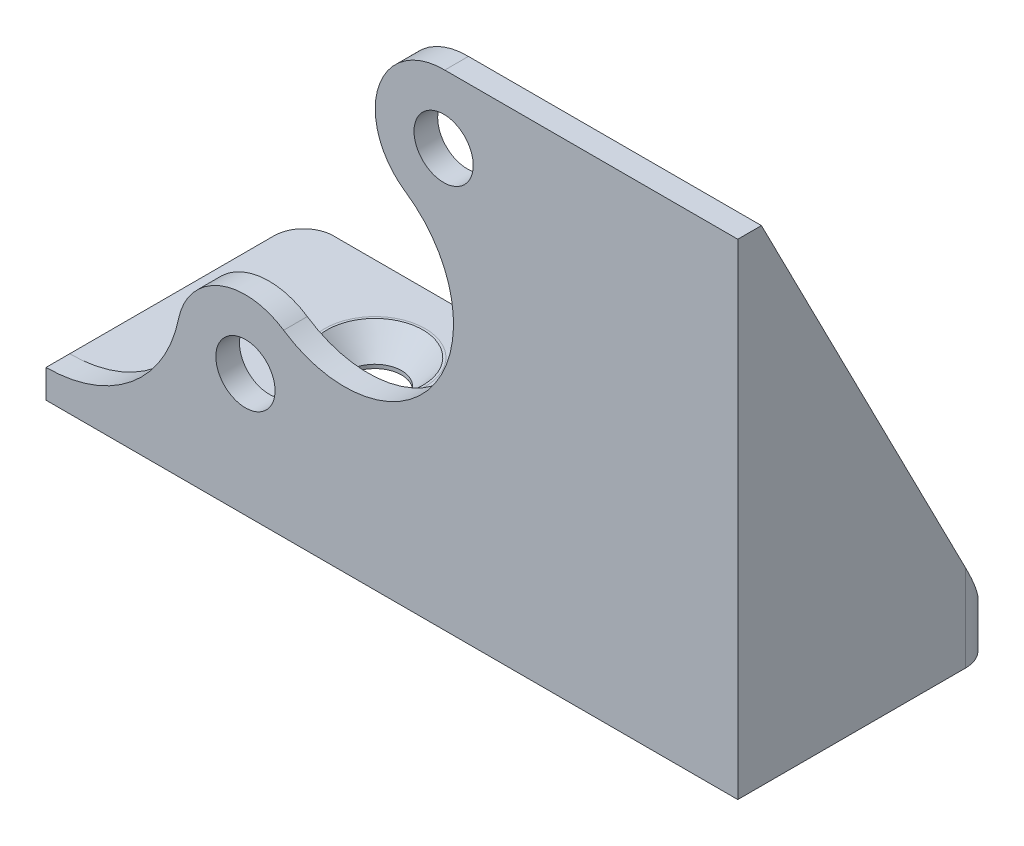
from build123d import *

# Parameters (mm, degrees)
SKETCH2_W                                   = 101.6
SKETCH2_H                                   = 127
BOSS_EXTRUDE1_DEPTH                         = 3.175
SKETCH5_R                                   = 3.9751
CUT_EXTRUDE1_DEPTH                          = 3.175
BOSS_EXTRUDE3_DEPTH                         = 92.87256
BOSS_EXTRUDE4_DEPTH                         = 6.35
SKETCH18_R                                  = 3.175
CUT_EXTRUDE3_DEPTH                          = 6.8072
FILLET4_R                                   = 4.0005
CUT_EXTRUDE4_DEPTH                          = 34.5948
CUT_EXTRUDE5_DEPTH                          = 2.9972
FILLET7_R                                   = 6.35
CSK_FOR_1_4_FLAT_HEAD_MACHINE_SCREW_2_COUNT = 2
CSK_FOR_1_4_FLAT_HEAD_MACHINE_SCREW_2_PITCH = 55.9
SKETCH36_R                                  = 6.4389
CUT_EXTRUDE6_DEPTH                          = 2.54


with BuildPart() as part:
    # Sketch2 → Boss-Extrude1 (new body)
    with BuildSketch(Plane.XY):
        with Locations((50.8, 63.5)):
            Rectangle(SKETCH2_W, SKETCH2_H)
    extrude(amount=BOSS_EXTRUDE1_DEPTH)

    # Sketch5 → Cut-Extrude1 (cut)
    with BuildSketch(Plane(origin=(0, 0, 0), x_dir=(-1, 0, 0), z_dir=(0, 0, -1))):
        with BuildLine():
            Line((-81.586228812, 65.152573183), (-58.571239337, 65.152573183))
            ThreePointArc((-58.571239337, 65.152573183), (-49.65943867, 58.729036089), (-53.287760408, 48.359981104))
            ThreePointArc((-53.287760408, 48.359981104), (-57.249364207, 28.049269577), (-36.93865268, 24.087665778))
            ThreePointArc((-36.93865268, 24.087665778), (-28.337713232, 24.971703827), (-22.817162059, 18.317291951))
            ThreePointArc((-22.817162059, 18.317291951), (-16.509170131, 7.896881921), (-5.03428, 3.81))
            Line((-5.03428, 3.81), (-5.03428, 0))
            Line((-5.03428, 0), (0, 0))
            Line((0, 0), (0, 127))
            Line((0, 127), (-101.6, 127))
            Line((-101.6, 127), (-101.6, 0))
            Line((-101.6, 0), (-97.90684, 0))
            Line((-97.90684, 0), (-97.90684, 65.152573183))
            Line((-97.90684, 65.152573183), (-81.586228812, 65.152573183))
        make_face()
        with Locations((-58.416247506, 55.973867932)):
            Circle(SKETCH5_R)
        with Locations((-31.810165582, 16.473778949)):
            Circle(SKETCH5_R)
    extrude(amount=-CUT_EXTRUDE1_DEPTH, mode=Mode.SUBTRACT)

    # Sketch10 → Boss-Extrude3 (add)
    with BuildSketch(Plane(origin=(5.03428, 0, 0), x_dir=(0, 0, -1), z_dir=(1, 0, 0))):
        Polygon((-3.175, 0), (-4.2418, 0), (-4.2418, -2.9972), (-34.5948, -2.9972), (-34.5948, 0), (-34.5948, 3.81), (-3.175, 3.81), align=None)
    extrude(amount=BOSS_EXTRUDE3_DEPTH)

    # Sketch11 → Boss-Extrude4 (add)
    with BuildSketch(Plane(origin=(97.90684, 0, 0), x_dir=(0, 0, -1), z_dir=(1, 0, 0))):
        Polygon((-3.175, 65.152573183), (-3.175, 3.81), (-34.5948, 3.81), align=None)
    extrude(amount=-BOSS_EXTRUDE4_DEPTH)

    # Sketch18 → Cut-Extrude3 (cut)
    with BuildSketch(Plane.XZ.offset(2.9972)):
        with Locations(Location((25.968032816, 23.228300068, 0), (0, 0, 270))):
            Circle(SKETCH18_R)
        with Locations(Location((81.868032816, 23.228300068, 0), (0, 0, 270))):
            Circle(SKETCH18_R)
    extrude(amount=-CUT_EXTRUDE3_DEPTH, mode=Mode.SUBTRACT)

    # Fillet4
    fillet4_edges = [part.edges().sort_by_distance(p)[0] for p in [
        (97.90684, -1.4986, 4.2418),
        (5.03428, -1.4986, 4.2418),
        (97.90684, 0.4064, 34.5948),
        (5.03428, 0.4064, 34.5948),
    ]]
    fillet(fillet4_edges, radius=FILLET4_R)

    # Mirror5: part across plane


with BuildPart() as part_1:
    add(part.part)
    add(part.part.mirror(Plane.XY))

    # Sketch25 → Cut-Extrude4 (cut)
    with BuildSketch(Plane.XY):
        Polygon((105.475480197, -15.241589329), (106.840773124, 71.833759528), (-8.541984089, 73.642896836), (-9.907277015, -13.432452021), align=None)
    extrude(amount=CUT_EXTRUDE4_DEPTH, mode=Mode.SUBTRACT)

    # Sketch28 → Cut-Extrude5 (cut)
    with BuildSketch(Plane.XZ.offset(2.9972)):
        with BuildLine():
            Line((93.90634, -4.2418), (9.03478, -4.2418))
            ThreePointArc((9.03478, -4.2418), (6.205999322, -5.413519322), (5.03428, -8.2423))
            Line((5.03428, -8.2423), (5.03428, -30.5943))
            ThreePointArc((5.03428, -30.5943), (6.205999322, -33.423080678), (9.03478, -34.5948))
            Line((9.03478, -34.5948), (93.90634, -34.5948))
            ThreePointArc((93.90634, -34.5948), (96.735120678, -33.423080678), (97.90684, -30.5943))
            Line((97.90684, -30.5943), (97.90684, -8.2423))
            ThreePointArc((97.90684, -8.2423), (96.735120678, -5.413519322), (93.90634, -4.2418))
        make_face()
    extrude(amount=-CUT_EXTRUDE5_DEPTH, mode=Mode.SUBTRACT)

    # Fillet7
    fillet7_edges = [part_1.edges().sort_by_distance(p)[0] for p in [
        (91.55684, 3.81, -18.8849),
    ]]
    fillet(fillet7_edges, radius=FILLET7_R)

    # Sketch35 → CSK for 1/4 Flat Head Machine Screw (100)1 (revolve, cut)
    with BuildSketch(Plane(origin=(25.968032816, 3.81, -23.228300068), x_dir=(0, 0, 1), z_dir=(1, 0, 0))):
        Polygon((0, 0), (0, 3.81), (3.57124, 3.81), (3.57124, 3.298865467), (6.4389, 0), align=None)
    csk_for_1_4_flat_head_machine_screw_100 = revolve(axis=Axis((25.968032816, 10.16, -23.228300068), (0, -1, 0)), mode=Mode.SUBTRACT)

    # CSK for 1_4 Flat Head Machine Screw  2: CSK for 1/4 Flat Head Machine Screw (100)1 ×2
    with Locations(*[(i * CSK_FOR_1_4_FLAT_HEAD_MACHINE_SCREW_2_PITCH, 0, 0) for i in range(1, CSK_FOR_1_4_FLAT_HEAD_MACHINE_SCREW_2_COUNT)]):
        add(csk_for_1_4_flat_head_machine_screw_100, mode=Mode.SUBTRACT)

    # Sketch36 → Cut-Extrude6 (cut)
    with BuildSketch(Plane(origin=(0, 3.81, 0), x_dir=(1, 0, 0), z_dir=(0, 1, 0))):
        with Locations((81.868032816, 23.228300068)):
            Circle(SKETCH36_R)
    extrude(amount=CUT_EXTRUDE6_DEPTH, mode=Mode.SUBTRACT)


solid = part_1.part
